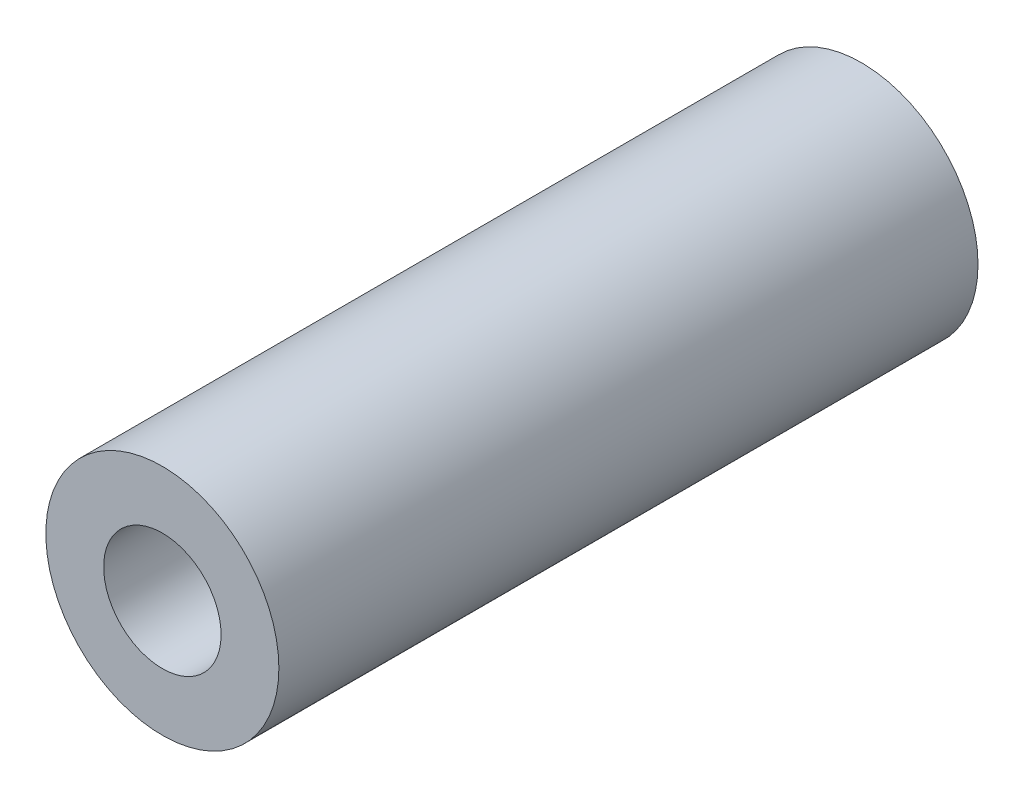
from build123d import *

# Parameters (mm, degrees)
BOSS_EXTRUDE1_DEPTH      = 152.4
BOSS_EXTRUDE1_DEPTH_BACK = 152.4
SKETCH3_R                = 6.35
SKETCH3_R_2              = 3.2004
SKETCH4_R                = 25.4
CUT_EXTRUDE1_DEPTH       = 266.7


with BuildPart() as part:
    # Sketch3 → Boss-Extrude1 (new, two sides: drawn at the far end of the back side and taken through both)
    with BuildSketch(Plane.XY.offset(-BOSS_EXTRUDE1_DEPTH_BACK)):
        Circle(SKETCH3_R)
        Circle(SKETCH3_R_2, mode=Mode.SUBTRACT)
    extrude(amount=BOSS_EXTRUDE1_DEPTH + BOSS_EXTRUDE1_DEPTH_BACK)

    # Sketch4 → Cut-Extrude1 (cut)
    with BuildSketch(Plane.XY.offset(152.4)):
        Circle(SKETCH4_R)
    extrude(amount=-CUT_EXTRUDE1_DEPTH, mode=Mode.SUBTRACT)


solid = part.part
